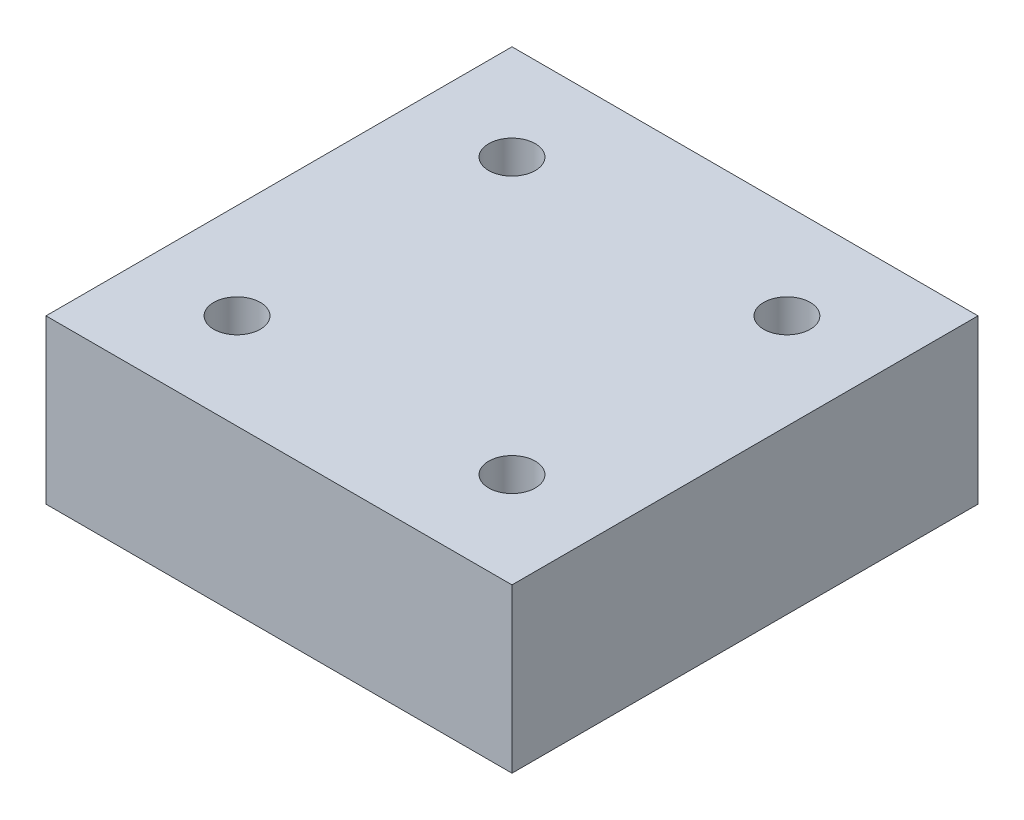
from build123d import *

# Parameters (mm, degrees)
SKETCH1_W           = 50.8
SKETCH1_H           = 50.8
BOSS_EXTRUDE1_DEPTH = 17.78
SKETCH2_R           = 2.54
CUT_EXTRUDE1_DEPTH  = 41.080523949


with BuildPart() as part:
    # Sketch1 → Boss-Extrude1 (new body)
    with BuildSketch(Plane(origin=(0, 0, 0), x_dir=(1, 0, 0), z_dir=(0, 1, 0))):
        Rectangle(SKETCH1_W, SKETCH1_H)
    extrude(amount=BOSS_EXTRUDE1_DEPTH)

    # Sketch2 → Cut-Extrude1 (cut, through all)
    with BuildSketch(Plane(origin=(0, 17.78, 0), x_dir=(1, 0, 0), z_dir=(0, 1, 0))):
        with Locations(Location((-14.986, 14.986, 0), (0, 0, 270))):
            Circle(SKETCH2_R)
        with Locations(Location((14.986, 14.986, 0), (0, 0, 270))):
            Circle(SKETCH2_R)
        with Locations(Location((14.986, -14.986, 0), (0, 0, 270))):
            Circle(SKETCH2_R)
        with Locations(Location((-14.986, -14.986, 0), (0, 0, 270))):
            Circle(SKETCH2_R)
    extrude(amount=-CUT_EXTRUDE1_DEPTH, mode=Mode.SUBTRACT)


solid = part.part
